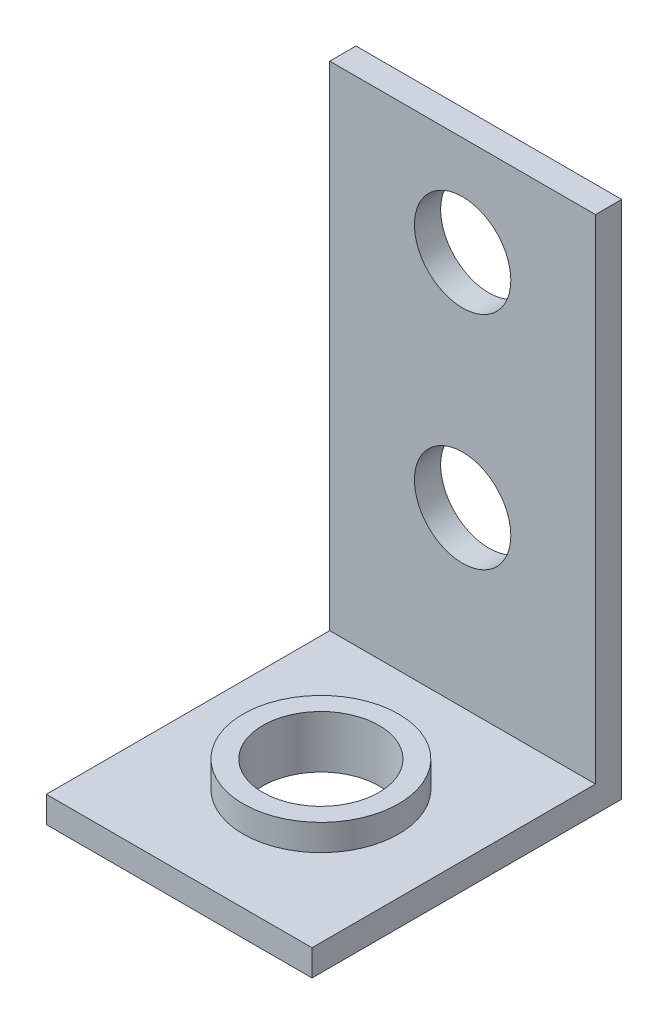
from build123d import *

# Parameters (mm, degrees)
SKETCH1_W           = 9.525
SKETCH1_H           = 11.0998
BOSS_EXTRUDE1_DEPTH = 0.9398
SKETCH2_W           = 9.525
SKETCH2_H           = 0.9398
BOSS_EXTRUDE2_DEPTH = 17.6784
CUT_EXTRUDE1_DEPTH  = 24.250561203
CUT_EXTRUDE2_DEPTH  = 23.944651046
BOSS_EXTRUDE3_START = 0.9398
SKETCH7_R           = 2.78765
SKETCH7_R_2         = 2.0828
BOSS_EXTRUDE3_DEPTH = 0.9398


with BuildPart() as part:
    # Sketch1 → Boss-Extrude1 (new body)
    with BuildSketch(Plane(origin=(0, 0, 0), x_dir=(1, 0, 0), z_dir=(0, 1, 0))):
        with Locations((4.7625, 5.5499)):
            Rectangle(SKETCH1_W, SKETCH1_H)
    extrude(amount=BOSS_EXTRUDE1_DEPTH)

    # Sketch2 → Boss-Extrude2 (add)
    with BuildSketch(Plane(origin=(0, 0.9398, 0), x_dir=(1, 0, 0), z_dir=(0, 1, 0))):
        with Locations((4.7625, 10.6299)):
            Rectangle(SKETCH2_W, SKETCH2_H)
    extrude(amount=BOSS_EXTRUDE2_DEPTH)

    # Sketch3 → Cut-Extrude1 (cut, through all)
    with BuildSketch(Plane.XY.offset(-10.16)):
        with BuildLine():
            ThreePointArc((6.4897, 15.0622), (5.983814832, 16.283514832), (4.7625, 16.7894))
            Line((4.7625, 16.7894), (4.7625, 13.335))
            ThreePointArc((4.7625, 13.335), (5.983814832, 13.840885168), (6.4897, 15.0622))
        make_face()
        with BuildLine():
            Line((4.7625, 13.335), (4.7625, 16.7894))
            ThreePointArc((4.7625, 16.7894), (3.0353, 15.0622), (4.7625, 13.335))
        make_face()
        with BuildLine():
            ThreePointArc((6.4897, 7.1374), (5.983814832, 8.358714832), (4.7625, 8.8646))
            Line((4.7625, 8.8646), (4.7625, 5.4102))
            ThreePointArc((4.7625, 5.4102), (5.983814832, 5.916085168), (6.4897, 7.1374))
        make_face()
        with BuildLine():
            Line((4.7625, 5.4102), (4.7625, 8.8646))
            ThreePointArc((4.7625, 8.8646), (3.0353, 7.1374), (4.7625, 5.4102))
        make_face()
    extrude(amount=-CUT_EXTRUDE1_DEPTH, mode=Mode.SUBTRACT)

    # Sketch4 → Cut-Extrude2 (cut, through all)
    with BuildSketch(Plane(origin=(0, 0.9398, 0), x_dir=(1, 0, 0), z_dir=(0, 1, 0))):
        with BuildLine():
            ThreePointArc((6.8453, 5.08), (6.235262004, 6.552762004), (4.7625, 7.1628))
            Line((4.7625, 7.1628), (4.7625, 5.08))
            Line((4.7625, 5.08), (6.8453, 5.08))
        make_face()
        with BuildLine():
            Line((4.7625, 5.08), (4.7625, 7.1628))
            ThreePointArc((4.7625, 7.1628), (3.289737996, 6.552762004), (2.6797, 5.08))
            Line((2.6797, 5.08), (4.7625, 5.08))
        make_face()
        with BuildLine():
            Line((6.8453, 5.08), (4.7625, 5.08))
            Line((4.7625, 5.08), (4.7625, 2.9972))
            ThreePointArc((4.7625, 2.9972), (6.235262004, 3.607237996), (6.8453, 5.08))
        make_face()
        with BuildLine():
            Line((4.7625, 2.9972), (4.7625, 5.08))
            Line((4.7625, 5.08), (2.6797, 5.08))
            ThreePointArc((2.6797, 5.08), (3.289737996, 3.607237996), (4.7625, 2.9972))
        make_face()
    extrude(amount=-CUT_EXTRUDE2_DEPTH, mode=Mode.SUBTRACT)

    # Sketch7 → Boss-Extrude3 (add)
    with BuildSketch(Plane(origin=(0, 0.9398, 0), x_dir=(1, 0, 0), z_dir=(0, 1, 0)).offset(BOSS_EXTRUDE3_START)):
        with Locations(Location((4.7625, 5.08, 0), (0, 0, 90))):
            Circle(SKETCH7_R)
        with Locations(Location((4.7625, 5.08, 0), (0, 0, 270))):
            Circle(SKETCH7_R_2, mode=Mode.SUBTRACT)
    extrude(amount=-BOSS_EXTRUDE3_DEPTH)


solid = part.part
